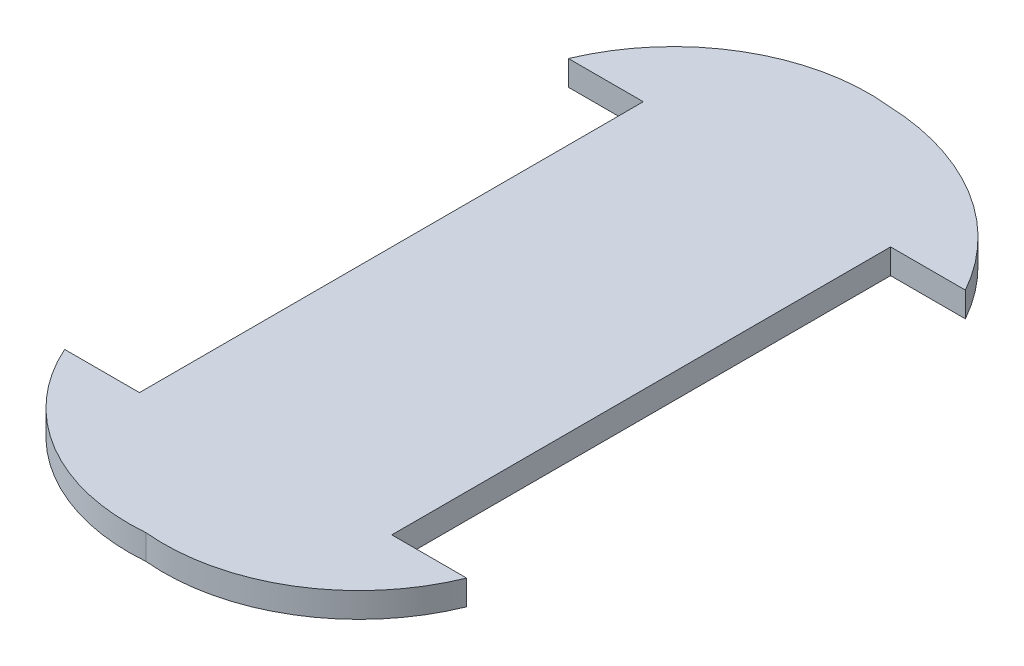
from build123d import *

# Parameters (mm, degrees)
BOSS_EXTRUDE2_DEPTH = 10


with BuildPart() as part:
    # Sketch1 → Boss-Extrude2 (new body)
    with BuildSketch(Plane(origin=(0, 0, 0), x_dir=(1, 0, 0), z_dir=(0, 1, 0))):
        with BuildLine():
            Line((50, 100), (50, -100))
            Line((50, -100), (80, -100))
            ThreePointArc((80, -100), (48.035495612, -137.511232206), (0, -148.53))
            ThreePointArc((0, -148.53), (-47.534227524, -137.586137939), (-80, -101.182229899))
            Line((-80, -101.182229899), (-50, -101.182229899))
            Line((-50, -101.182229899), (-50, 100.833366542))
            Line((-50, 100.833366542), (-80, 100.833366542))
            ThreePointArc((-80, 100.833366542), (-47.524044038, 138.098471025), (0.795654444, 148.518762113))
            ThreePointArc((0.795654444, 148.518762113), (46.745634315, 134.621844661), (80, 100))
            Line((80, 100), (50, 100))
        make_face()
    extrude(amount=BOSS_EXTRUDE2_DEPTH)


solid = part.part
